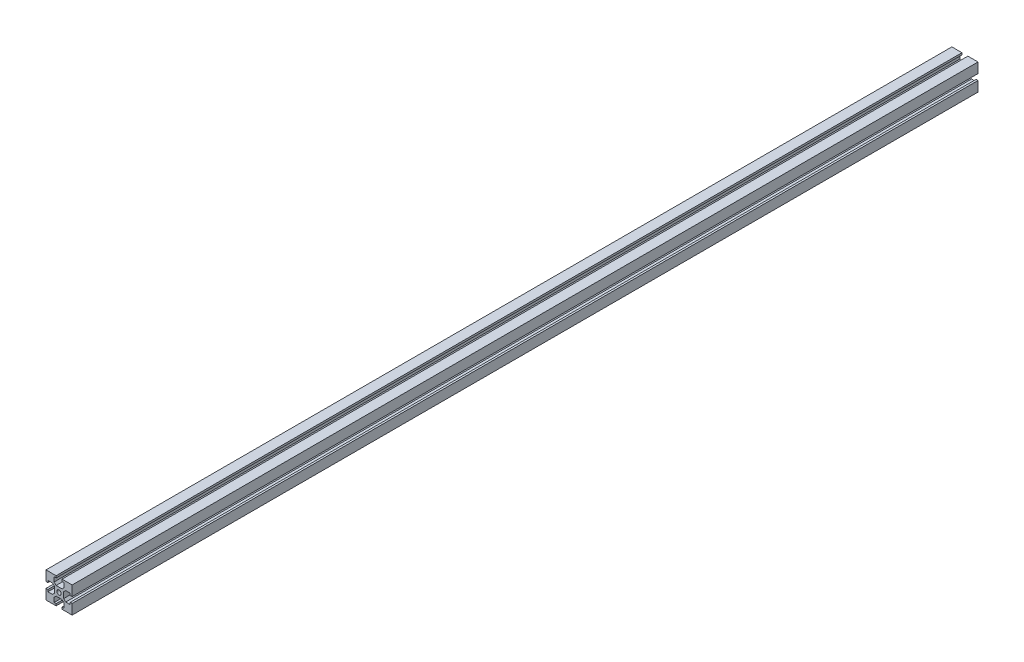
from build123d import *

# Parameters (mm, degrees)
SKETCH_2_R      = 1.25
EXTRUDE_1_DEPTH = 520


with BuildPart() as part:
    # ｽｹｯﾁ2 → ﾎﾞｽ - 押し出し1 (new body)
    with BuildSketch(Plane.XY):
        Polygon((1.7, 2.65), (-1.7, 2.65), (-2.85, 3.8), (-2.85, 6.4), (-1.7, 6.4), (-1.7, 7.5), (-7.5, 7.5), (-7.5, 1.7), (-6.4, 1.7), (-6.4, 2.85), (-3.8, 2.85), (-2.65, 1.7), (-2.65, -1.7), (-3.8, -2.85), (-6.4, -2.85), (-6.4, -1.7), (-7.5, -1.7), (-7.5, -7.5), (-1.7, -7.5), (-1.7, -6.4), (-2.85, -6.4), (-2.85, -3.8), (-1.7, -2.65), (1.7, -2.65), (2.85, -3.8), (2.85, -6.4), (1.7, -6.4), (1.7, -7.5), (7.5, -7.5), (7.5, -1.7), (6.4, -1.7), (6.4, -2.85), (3.8, -2.85), (2.65, -1.7), (2.65, 1.7), (3.8, 2.85), (6.4, 2.85), (6.4, 1.7), (7.5, 1.7), (7.5, 7.5), (1.7, 7.5), (1.7, 6.4), (2.85, 6.4), (2.85, 3.8), align=None)
        Circle(SKETCH_2_R, mode=Mode.SUBTRACT)
    extrude(amount=EXTRUDE_1_DEPTH)


solid = part.part
